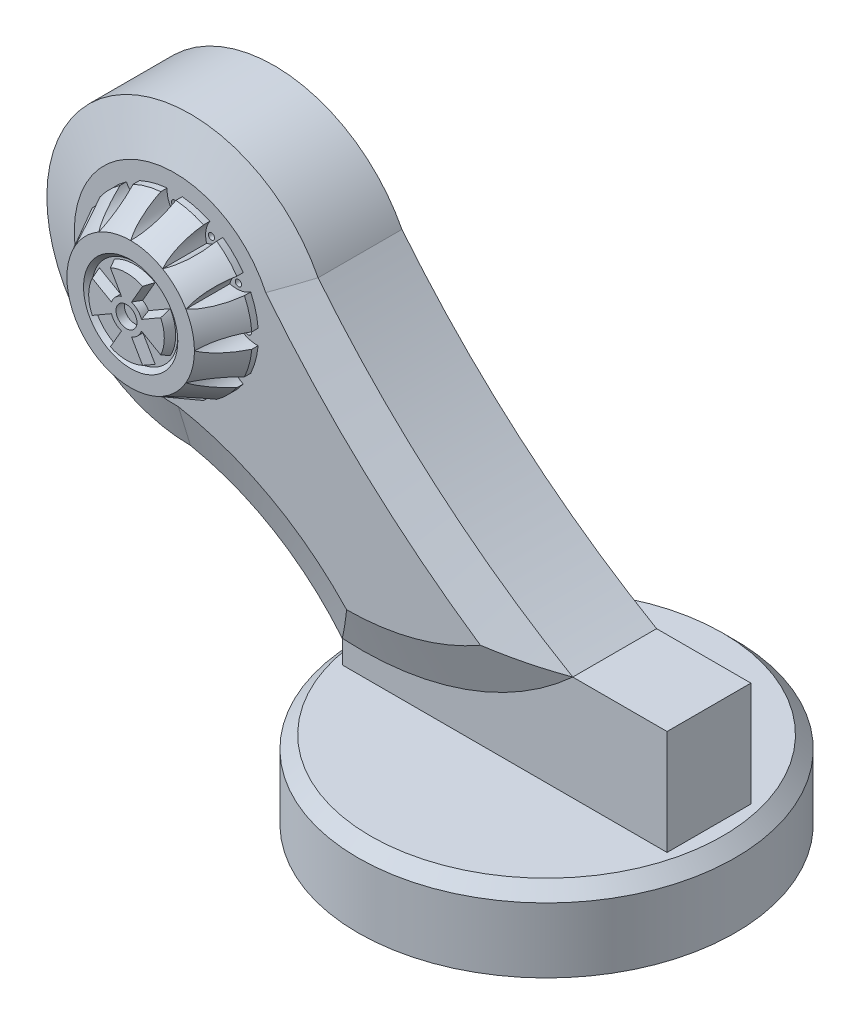
from build123d import *

# Parameters (mm, degrees)
SKETCH1_R            = 90
BOSS_EXTRUDE1_DEPTH  = 37
CHAMFER1_SIZE        = 6
SKETCH2_W            = 155
SKETCH2_H            = 40
BOSS_EXTRUDE2_DEPTH  = 50
CUT_EXTRUDE1_DEPTH   = 167.640331253
BOSS_EXTRUDE4_DEPTH  = 20
BOSS_EXTRUDE5_DEPTH  = 7.5
BOSS_EXTRUDE5_DRAFT  = 70
SKETCH8_R            = 40
BOSS_EXTRUDE6_DEPTH  = 3
SKETCH9_R            = 40
BOSS_EXTRUDE7_DEPTH  = 18
BOSS_EXTRUDE7_TAPER  = 28
CUT_EXTRUDE2_REACH   = 347.162
SKETCH11_R           = 1.5
CUT_EXTRUDE3_DEPTH   = 5
CIRPATTERN1_COUNT    = 12
SKETCH12_R           = 22.5
CUT_EXTRUDE4_DEPTH   = 2
CUT_EXTRUDE4_DRAFT   = -45
BOSS_EXTRUDE9_DEPTH  = 4
BOSS_EXTRUDE9_TAPER  = 20
CIRPATTERN2_COUNT    = 4
SKETCH14_R           = 7.54913661
BOSS_EXTRUDE10_DEPTH = 4
SKETCH15_R           = 5
CUT_EXTRUDE5_DEPTH   = 4
SKETCH16_R           = 15
CUT_EXTRUDE6_DEPTH   = 20
SKETCH17_R           = 15
CUT_EXTRUDE7_DEPTH   = 20


with BuildPart() as part:
    # Sketch1 → Boss-Extrude1 (new body)
    with BuildSketch(Plane(origin=(0, 0, 0), x_dir=(1, 0, 0), z_dir=(0, 1, 0))):
        with Locations(Location((0, 0, 0), (0, 0, 270))):
            Circle(SKETCH1_R)
    extrude(amount=BOSS_EXTRUDE1_DEPTH)

    # Chamfer1
    chamfer1_edges = [part.edges().sort_by_distance(p)[0] for p in [
        (0, 37, -90),
    ]]
    chamfer(chamfer1_edges, length=CHAMFER1_SIZE)

    # Sketch2 → Boss-Extrude2 (add)
    with BuildSketch(Plane(origin=(0, 37, 0), x_dir=(1, 0, 0), z_dir=(0, 1, 0))):
        Rectangle(SKETCH2_W, SKETCH2_H)
    extrude(amount=BOSS_EXTRUDE2_DEPTH)

    # Sketch4 → Cut-Extrude1 (cut, through all)
    with BuildSketch(Plane.XY.offset(20)):
        with BuildLine():
            Line((-77.5, 87), (32.5, 87))
            ThreePointArc((32.5, 87), (-18.551432041, 56.363013449), (-77.5, 48))
            Line((-77.5, 48), (-77.5, 87))
        make_face()
    extrude(amount=-CUT_EXTRUDE1_DEPTH, mode=Mode.SUBTRACT)


with BuildPart() as body_2:
    # Sketch5 → Boss-Extrude4 (new, symmetric)
    with BuildSketch(Plane.XY):
        with BuildLine():
            ThreePointArc((-89.039563006, 191.24220097), (-208.448014365, 195.722256603), (-150, 91.5))
            ThreePointArc((-150, 91.5), (-109.960480223, 76.065866296), (-77.5, 48))
            ThreePointArc((-77.5, 48), (-18.551432041, 56.363013449), (32.5, 87))
            ThreePointArc((32.5, 87), (-33.051517386, 133.545910358), (-89.039563006, 191.24220097))
        make_face()
    extrude(amount=BOSS_EXTRUDE4_DEPTH, both=True)


with BuildPart() as boss_extrude5_tool:
    # Sketch7 → Boss-Extrude5 (with draft: the straight prism first)
    with BuildSketch(Plane.XY.offset(20)):
        with BuildLine():
            ThreePointArc((-77.5, 48), (-18.551432041, 56.363013449), (32.5, 87))
            ThreePointArc((32.5, 87), (-33.051517386, 133.545910358), (-89.039563006, 191.24220097))
            ThreePointArc((-89.039563006, 191.24220097), (-208.448014365, 195.722256603), (-150, 91.5))
            ThreePointArc((-150, 91.5), (-109.960480223, 76.065866296), (-77.5, 48))
        make_face()
    extrude(amount=BOSS_EXTRUDE5_DEPTH)
    # Boss-Extrude5: the draft: its side faces are tilted about the plane it starts from
    boss_extrude5_sides = [boss_extrude5_tool.faces().sort_by_distance(p)[0] for p in [
        (-33.051517386, 133.545910358, 23.75),
        (-208.448014365, 195.722256603, 23.75),
        (-109.960480223, 76.065866296, 23.75),
        (-18.551432041, 56.363013449, 23.75),
    ]]
    draft(boss_extrude5_sides, Plane.XY.offset(20), BOSS_EXTRUDE5_DRAFT)


with BuildPart() as part_1:
    add(part.part)

    # Boss-Extrude5: add boss_extrude5_tool
    add(boss_extrude5_tool.part)

    add(body_2.part)  # Boss-Extrude5 merges body 2

    # Sketch8 → Boss-Extrude6 (add)
    with BuildSketch(Plane.XY.offset(27.5)):
        with Locations((-150, 160)):
            Circle(SKETCH8_R)
    extrude(amount=BOSS_EXTRUDE6_DEPTH)

    # Sketch9 → Boss-Extrude7 (add)
    with BuildSketch(Plane.XY.offset(30.5)):
        with Locations((-150, 160)):
            Circle(SKETCH9_R)
    extrude(amount=BOSS_EXTRUDE7_DEPTH, taper=BOSS_EXTRUDE7_TAPER)

    # Cut-Extrude2: up to this face of the body (flat: up to its plane)
    cut_extrude2_end = Plane(part_1.part.faces().sort_by_distance((-94.954403554, 123.419887586, 27.5))[0])
    # Sketch10 → Cut-Extrude2 (cut, up to the picked face)
    with BuildSketch(Plane.XY.offset(48.5), mode=Mode.PRIVATE) as cut_extrude2_sk1:
        with BuildLine():
            ThreePointArc((-146.4004895, 199.837714846), (-150, 200), (-153.5995105, 199.837714846))
            ThreePointArc((-153.5995105, 199.837714846), (-152.83480642, 194.737481291), (-150, 190.42923023))
            ThreePointArc((-150, 190.42923023), (-147.16519358, 194.737481291), (-146.4004895, 199.837714846))
        make_face()
    cut_extrude2_tool1 = split(extrude(cut_extrude2_sk1.sketch, amount=-CUT_EXTRUDE2_REACH, mode=Mode.PRIVATE), bisect_by=cut_extrude2_end, keep=Keep.BOTH, mode=Mode.PRIVATE)
    cut_extrude2 = cut_extrude2_tool1.solids().sort_by(Axis((-150, 196.229247, 48.5), (0, 0, -1)))[0]
    add(cut_extrude2, mode=Mode.SUBTRACT)

    # Sketch11 → Cut-Extrude3 (cut)
    with BuildSketch(Plane.XY.offset(27.5)):
        with Locations((-150, 195.133472538)):
            Circle(SKETCH11_R)
    cut_extrude3 = extrude(amount=-CUT_EXTRUDE3_DEPTH, mode=Mode.SUBTRACT)

    # CirPattern1: Cut-Extrude2, Cut-Extrude3 ×12 about axis
    cirpattern1_axis = Axis((-150, 160, 0), (0, 0, 1))
    add([cut_extrude2.rotate(cirpattern1_axis, i * 360 / CIRPATTERN1_COUNT) for i in range(1, CIRPATTERN1_COUNT)], mode=Mode.SUBTRACT)
    add([cut_extrude3.rotate(cirpattern1_axis, i * 360 / CIRPATTERN1_COUNT) for i in range(1, CIRPATTERN1_COUNT)], mode=Mode.SUBTRACT)


with BuildPart() as cut_extrude4_tool:
    # Sketch12 → Cut-Extrude4 (with draft: the straight prism first)
    with BuildSketch(Plane.XY.offset(48.5)):
        with Locations((-150, 160)):
            Circle(SKETCH12_R)
    extrude(amount=-CUT_EXTRUDE4_DEPTH)
    # Cut-Extrude4: the draft: its side faces are tilted about the plane it starts from
    cut_extrude4_sides = [cut_extrude4_tool.faces().sort_by_distance(p)[0] for p in [
        (-172.5, 160, 47.5),
    ]]
    draft(cut_extrude4_sides, Plane.XY.offset(48.5), CUT_EXTRUDE4_DRAFT)


with BuildPart() as part_2:
    add(part_1.part)

    # Cut-Extrude4: cut by cut_extrude4_tool
    add(cut_extrude4_tool.part, mode=Mode.SUBTRACT)

    # Sketch13 → Boss-Extrude9 (add)
    with BuildSketch(Plane.XY.offset(46.5)):
        with BuildLine():
            Line((-159.703453524, 176.9142836), (-153, 165.303561511))
            ThreePointArc((-153, 165.303561511), (-150, 166.093255673), (-147, 165.303561511))
            Line((-147, 165.303561511), (-140.296546476, 176.9142836))
            ThreePointArc((-140.296546476, 176.9142836), (-150, 179.5), (-159.703453524, 176.9142836))
        make_face()
    boss_extrude9 = extrude(amount=BOSS_EXTRUDE9_DEPTH, taper=BOSS_EXTRUDE9_TAPER)

    # CirPattern2: Boss-Extrude9 ×4 about axis
    cirpattern2_axis = Axis((-150, 160, 0), (0, 0, 1))
    for i in range(1, CIRPATTERN2_COUNT):
        add(boss_extrude9.rotate(cirpattern2_axis, i * 360 / CIRPATTERN2_COUNT))

    # Sketch14 → Boss-Extrude10 (add)
    with BuildSketch(Plane.XY.offset(46.5)):
        with Locations((-150, 160)):
            Circle(SKETCH14_R)
    extrude(amount=BOSS_EXTRUDE10_DEPTH)

    # Sketch15 → Cut-Extrude5 (cut)
    with BuildSketch(Plane.XY.offset(50.5)):
        with Locations((-150, 160)):
            Circle(SKETCH15_R)
    extrude(amount=-CUT_EXTRUDE5_DEPTH, mode=Mode.SUBTRACT)

    # Sketch16 → Cut-Extrude6 (cut)
    with BuildSketch(Plane(origin=(0, 0, -20), x_dir=(-1, 0, 0), z_dir=(0, 0, -1))):
        with Locations((150, 160)):
            Circle(SKETCH16_R)
    extrude(amount=-CUT_EXTRUDE6_DEPTH, mode=Mode.SUBTRACT)

    # Sketch17 → Cut-Extrude7 (cut)
    with BuildSketch(Plane.XZ):
        with Locations(Location((0, 0, 0), (0, 0, 270))):
            Circle(SKETCH17_R)
    extrude(amount=-CUT_EXTRUDE7_DEPTH, mode=Mode.SUBTRACT)


solid = part_2.part
